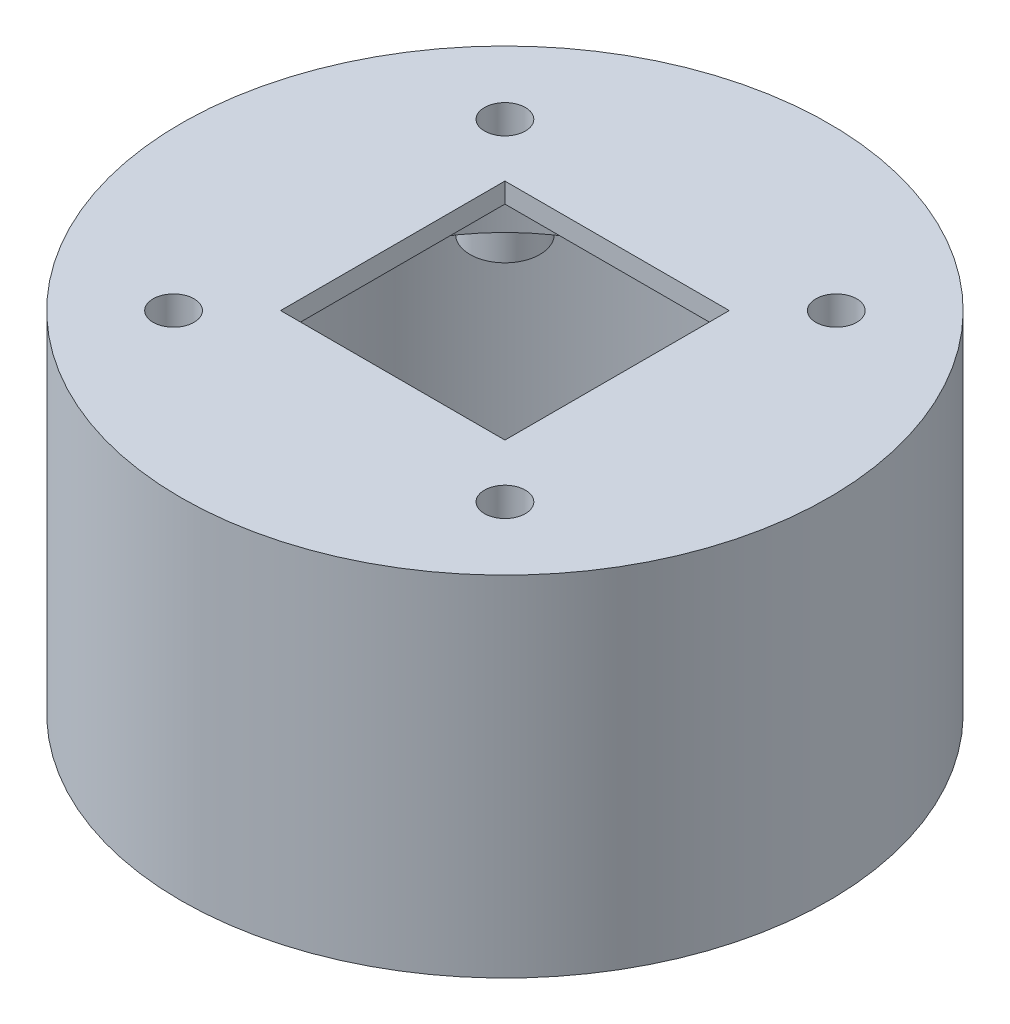
from build123d import *

# Parameters (mm, degrees)
SKETCH1_R           = 65
SKETCH1_R_2         = 60
BOSS_EXTRUDE1_DEPTH = 50
SKETCH2_R           = 65
BOSS_EXTRUDE2_DEPTH = 20
SKETCH3_R           = 4.1
SKETCH3_W           = 45
SKETCH3_H           = 45
CUT_EXTRUDE1_DEPTH  = 116.542200083
SKETCH5_W           = 45
SKETCH5_H           = 25
CUT_EXTRUDE2_DEPTH  = 15
SKETCH6_R           = 50
CUT_EXTRUDE3_DEPTH  = 6
SKETCH7_R           = 7
SKETCH7_R_2         = 4.1
BOSS_EXTRUDE3_DEPTH = 6
SKETCH8_R           = 39
CUT_EXTRUDE4_DEPTH  = 10


with BuildPart() as part:
    # Sketch1 → Boss-Extrude1 (new body)
    with BuildSketch(Plane(origin=(0, 0, 0), x_dir=(1, 0, 0), z_dir=(0, 1, 0))):
        with Locations(Location((0, 0, 0), (0, 0, 270))):
            Circle(SKETCH1_R)
        with Locations(Location((0, 0, 0), (0, 0, 270))):
            Circle(SKETCH1_R_2, mode=Mode.SUBTRACT)
    extrude(amount=BOSS_EXTRUDE1_DEPTH)

    # Sketch2 → Boss-Extrude2 (add)
    with BuildSketch(Plane(origin=(0, 50, 0), x_dir=(1, 0, 0), z_dir=(0, 1, 0))):
        with Locations(Location((0, 0, 0), (0, 0, 270))):
            Circle(SKETCH2_R)
    extrude(amount=BOSS_EXTRUDE2_DEPTH)

    # Sketch3 → Cut-Extrude1 (cut, through all)
    with BuildSketch(Plane(origin=(0, 70, 0), x_dir=(1, 0, 0), z_dir=(0, 1, 0))):
        with Locations(Location((-33.234018716, -33.234018716, 0), (0, 0, 270))):
            Circle(SKETCH3_R)
        with Locations(Location((-33.234018716, 33.234018716, 0), (0, 0, 270))):
            Circle(SKETCH3_R)
        with Locations(Location((33.234018716, 33.234018716, 0), (0, 0, 270))):
            Circle(SKETCH3_R)
        with Locations(Location((33.234018716, -33.234018716, 0), (0, 0, 270))):
            Circle(SKETCH3_R)
        Rectangle(SKETCH3_W, SKETCH3_H)
    extrude(amount=-CUT_EXTRUDE1_DEPTH, mode=Mode.SUBTRACT)

    # Sketch5 → Cut-Extrude2 (cut)
    with BuildSketch(Plane.XZ.offset(-50)):
        with Locations((0, 35)):
            Rectangle(SKETCH5_W, SKETCH5_H)
    extrude(amount=-CUT_EXTRUDE2_DEPTH, mode=Mode.SUBTRACT)

    # Sketch6 → Cut-Extrude3 (cut)
    with BuildSketch(Plane.XZ.offset(-50)):
        Circle(SKETCH6_R)
    extrude(amount=-CUT_EXTRUDE3_DEPTH, mode=Mode.SUBTRACT)

    # Sketch7 → Boss-Extrude3 (add)
    # profile 1 of 4: a face of its own
    with BuildSketch(Plane.XZ.offset(-56)):
        with Locations((-33.234018716, -33.234018716)):
            Circle(SKETCH7_R)
        with Locations(Location((-33.234018716, -33.234018716, 0), (0, 0, 90))):
            Circle(SKETCH7_R_2, mode=Mode.SUBTRACT)
    # profile 2 of 4: a face of its own
    with BuildSketch(Plane.XZ.offset(-56)):
        with Locations((-33.234018716, 33.234018716)):
            Circle(SKETCH7_R)
        with Locations(Location((-33.234018716, 33.234018716, 0), (0, 0, 90))):
            Circle(SKETCH7_R_2, mode=Mode.SUBTRACT)
    # profile 3 of 4: a face of its own
    with BuildSketch(Plane.XZ.offset(-56)):
        with Locations((33.234018716, -33.234018716)):
            Circle(SKETCH7_R)
        with Locations(Location((33.234018716, -33.234018716, 0), (0, 0, 90))):
            Circle(SKETCH7_R_2, mode=Mode.SUBTRACT)
    # profile 4 of 4: a face of its own
    with BuildSketch(Plane.XZ.offset(-56)):
        with Locations((33.234018716, 33.234018716)):
            Circle(SKETCH7_R)
        with Locations(Location((33.234018716, 33.234018716, 0), (0, 0, 90))):
            Circle(SKETCH7_R_2, mode=Mode.SUBTRACT)
    extrude(amount=BOSS_EXTRUDE3_DEPTH)

    # Sketch8 → Cut-Extrude4 (cut)
    with BuildSketch(Plane.XZ.offset(-56)):
        with Locations(Location((0, 0, 0), (0, 0, 270))):
            Circle(SKETCH8_R)
    extrude(amount=-CUT_EXTRUDE4_DEPTH, mode=Mode.SUBTRACT)


solid = part.part
